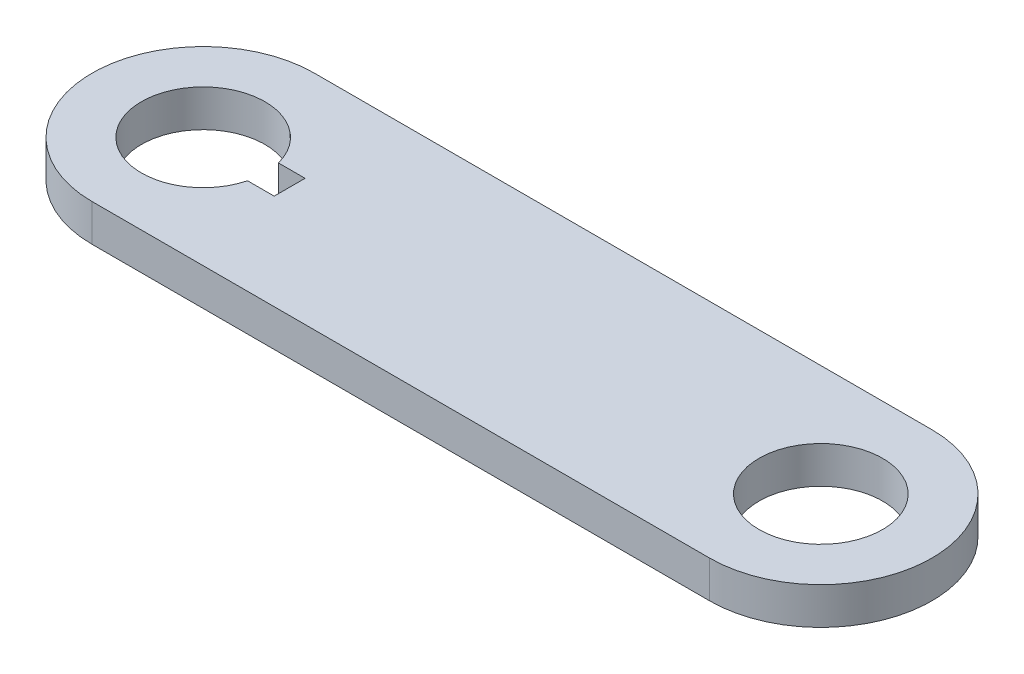
from build123d import *

# Parameters (mm, degrees)
SKETCH1_R           = 5
BOSS_EXTRUDE1_DEPTH = 1.5


with BuildPart() as part:
    # Sketch1 → Boss-Extrude1 (new, symmetric)
    with BuildSketch(Plane(origin=(0, 0, 0), x_dir=(1, 0, 0), z_dir=(0, 1, 0))):
        with BuildLine():
            Line((50, 9), (0, 9))
            ThreePointArc((0, 9), (-9, 0), (0, -9))
            Line((0, -9), (50, -9))
            ThreePointArc((50, -9), (59, 0), (50, 9))
        make_face()
        with BuildLine():
            ThreePointArc((4.841229183, -1.25), (-5, 0), (4.841229183, 1.25))
            Line((4.841229183, 1.25), (7, 1.25))
            Line((7, 1.25), (7, -1.25))
            Line((7, -1.25), (4.841229183, -1.25))
        make_face(mode=Mode.SUBTRACT)
        with Locations(Location((50, 0, 0), (0, 0, 270))):
            Circle(SKETCH1_R, mode=Mode.SUBTRACT)
    extrude(amount=BOSS_EXTRUDE1_DEPTH, both=True)


solid = part.part
